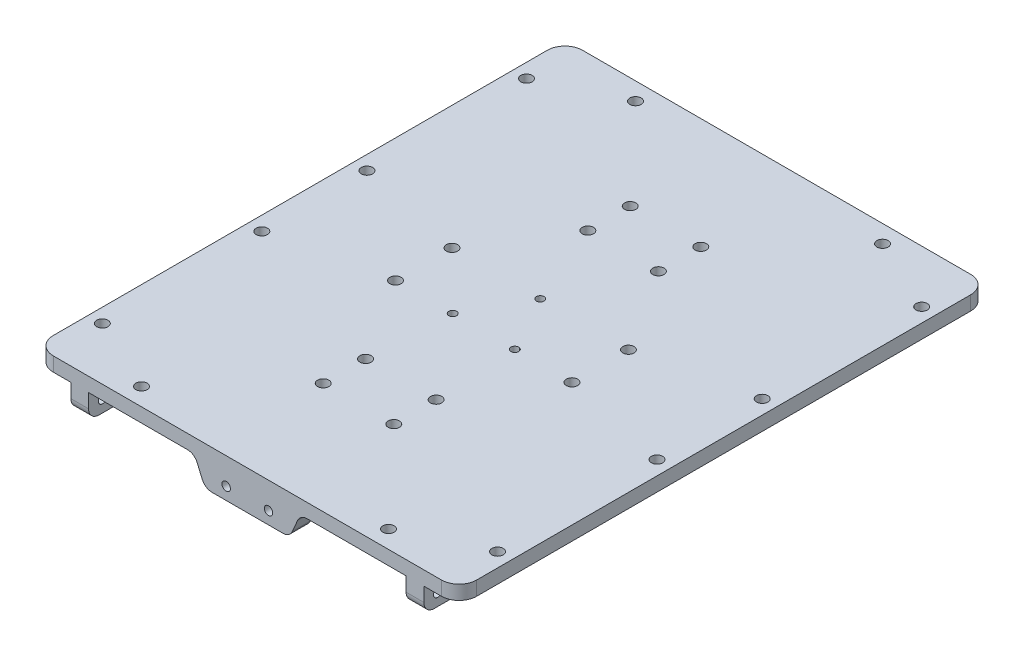
from build123d import *

# Parameters (mm, degrees)
SKETCH_1_W      = 120
SKETCH_1_H      = 150
SKETCH_1_R      = 1.6
SKETCH_1_R_2    = 1.1
EXTRUDE_1_DEPTH = 4
SKETCH_2_R      = 1.25
EXTRUDE_2_DEPTH = 5
SKETCH_3_R      = 1.2
EXTRUDE_3_DEPTH = 5
FILLET_1_R      = 5
FILLET_3_R      = 3


with BuildPart() as part:
    # 草图1 → 凸台-拉伸1 (new body)
    with BuildSketch(Plane(origin=(0, 0, 0), x_dir=(1, 0, 0), z_dir=(0, 1, 0))):
        Rectangle(SKETCH_1_W, SKETCH_1_H)
        with Locations(Location((-56, 60.1, 0), (0, 0, 270))):
            Circle(SKETCH_1_R, mode=Mode.SUBTRACT)
        with Locations(Location((-56, 14.9, 0), (0, 0, 90))):
            Circle(SKETCH_1_R, mode=Mode.SUBTRACT)
        with Locations(Location((-10, 43.5, 0), (0, 0, 270))):
            Circle(SKETCH_1_R, mode=Mode.SUBTRACT)
        with Locations(Location((-10, 31.5, 0), (0, 0, 90))):
            Circle(SKETCH_1_R, mode=Mode.SUBTRACT)
        with Locations(Location((-56, -14.9, 0), (0, 0, 270))):
            Circle(SKETCH_1_R, mode=Mode.SUBTRACT)
        with Locations(Location((-10, -31.5, 0), (0, 0, 270))):
            Circle(SKETCH_1_R, mode=Mode.SUBTRACT)
        with Locations(Location((-10, -43.5, 0), (0, 0, 90))):
            Circle(SKETCH_1_R, mode=Mode.SUBTRACT)
        with Locations(Location((-56, -60.1, 0), (0, 0, 90))):
            Circle(SKETCH_1_R, mode=Mode.SUBTRACT)
        with Locations(Location((56, -60.1, 0), (0, 0, 270))):
            Circle(SKETCH_1_R, mode=Mode.SUBTRACT)
        with Locations(Location((10, -43.5, 0), (0, 0, 270))):
            Circle(SKETCH_1_R, mode=Mode.SUBTRACT)
        with Locations(Location((10, -31.5, 0), (0, 0, 90))):
            Circle(SKETCH_1_R, mode=Mode.SUBTRACT)
        with Locations(Location((56, -14.9, 0), (0, 0, 90))):
            Circle(SKETCH_1_R, mode=Mode.SUBTRACT)
        with Locations(Location((56, 14.9, 0), (0, 0, 270))):
            Circle(SKETCH_1_R, mode=Mode.SUBTRACT)
        with Locations(Location((10, 31.5, 0), (0, 0, 270))):
            Circle(SKETCH_1_R, mode=Mode.SUBTRACT)
        with Locations(Location((10, 43.5, 0), (0, 0, 90))):
            Circle(SKETCH_1_R, mode=Mode.SUBTRACT)
        with Locations(Location((56, 60.1, 0), (0, 0, 90))):
            Circle(SKETCH_1_R, mode=Mode.SUBTRACT)
        with Locations(Location((0, 8, 0), (0, 0, 270))):
            Circle(SKETCH_1_R_2, mode=Mode.SUBTRACT)
        with Locations(Location((8.8, -8, 0), (0, 0, 270))):
            Circle(SKETCH_1_R_2, mode=Mode.SUBTRACT)
        with Locations(Location((-8.8, -8, 0), (0, 0, 270))):
            Circle(SKETCH_1_R_2, mode=Mode.SUBTRACT)
        with Locations(Location((-25, 8, 0), (0, 0, 270))):
            Circle(SKETCH_1_R, mode=Mode.SUBTRACT)
        with Locations(Location((25, 8, 0), (0, 0, 90))):
            Circle(SKETCH_1_R, mode=Mode.SUBTRACT)
        with Locations(Location((25, -8, 0), (0, 0, 270))):
            Circle(SKETCH_1_R, mode=Mode.SUBTRACT)
        with Locations(Location((-25, -8, 0), (0, 0, 90))):
            Circle(SKETCH_1_R, mode=Mode.SUBTRACT)
        with Locations(Location((35, 70, 0), (0, 0, 270))):
            Circle(SKETCH_1_R, mode=Mode.SUBTRACT)
        with Locations(Location((-35, 70, 0), (0, 0, 90))):
            Circle(SKETCH_1_R, mode=Mode.SUBTRACT)
        with Locations(Location((-35, -70, 0), (0, 0, 270))):
            Circle(SKETCH_1_R, mode=Mode.SUBTRACT)
        with Locations(Location((35, -70, 0), (0, 0, 90))):
            Circle(SKETCH_1_R, mode=Mode.SUBTRACT)
    extrude(amount=EXTRUDE_1_DEPTH)

    # 草图2 → 凸台-拉伸2 (add)
    # profile 1 of 3: a face of its own
    with BuildSketch(Plane.ZY.offset(50)):
        Polygon((45, 0), (75, 0), (75, -7), (57.124355653, -7), align=None)
        with Locations((71, -3.5)):
            Circle(SKETCH_2_R, mode=Mode.SUBTRACT)
        with Locations((65, -3.5)):
            Circle(SKETCH_2_R, mode=Mode.SUBTRACT)
        with Locations((59, -3.5)):
            Circle(SKETCH_2_R, mode=Mode.SUBTRACT)
    # profile 2 of 3: a face of its own
    with BuildSketch(Plane.ZY.offset(50)):
        Polygon((-57.124355653, -7), (-75, -7), (-75, 0), (-45, 0), align=None)
        with Locations((-71, -3.5)):
            Circle(SKETCH_2_R, mode=Mode.SUBTRACT)
        with Locations((-65, -3.5)):
            Circle(SKETCH_2_R, mode=Mode.SUBTRACT)
        with Locations((-59, -3.5)):
            Circle(SKETCH_2_R, mode=Mode.SUBTRACT)
    # profile 3 of 3: a face of its own
    with BuildSketch(Plane.ZY.offset(50)):
        Polygon((-25, 0), (25, 0), (17, -7), (-17, -7), align=None)
    extrude_2 = extrude(amount=-EXTRUDE_2_DEPTH)

    # 镜向1: 凸台-拉伸2 across plane
    add(extrude_2.mirror(Plane.ZY))

    # 草图3 → 凸台-拉伸3 (add)
    with BuildSketch(Plane.XY.offset(75)):
        Polygon((-15, 0), (15, 0), (12, -7), (-12, -7), align=None)
        with Locations((6, -3.5)):
            Circle(SKETCH_3_R, mode=Mode.SUBTRACT)
        with Locations(Location((-6, -3.5, 0), (0, 0, 180))):
            Circle(SKETCH_3_R, mode=Mode.SUBTRACT)
    extrude_3 = extrude(amount=-EXTRUDE_3_DEPTH)

    # 镜向2: 凸台-拉伸3 across plane
    add(extrude_3.mirror(Plane.XY))

    # 圆角1
    fillet_1_edges = [part.edges().sort_by_distance(p)[0] for p in [
        (60, 2, 75),
        (-60, 2, 75),
        (-60, 2, -75),
        (60, 2, -75),
    ]]
    fillet(fillet_1_edges, radius=FILLET_1_R)

    # 圆角3
    fillet_3_edges = [part.edges().sort_by_distance(p)[0] for p in [
        (-47.5, 0, 45),
        (-47.5, -7, 57.124355653),
        (-47.5, -7, 75),
        (47.5, -7, 75),
        (47.5, -7, 57.124355653),
        (47.5, 0, 45),
        (47.5, 0, -45),
        (-47.5, 0, -45),
        (47.5, -7, -75),
        (47.5, -7, -57.124355653),
        (-47.5, -7, -57.124355653),
        (-47.5, -7, -75),
        (-47.5, -7, 17),
        (-47.5, 0, 25),
        (-47.5, 0, -25),
        (-47.5, -7, -17),
        (47.5, 0, -25),
        (47.5, -7, -17),
        (47.5, -7, 17),
        (47.5, 0, 25),
        (-12, -7, -72.5),
        (-15, 0, -72.5),
        (12, -7, -72.5),
        (15, 0, -72.5),
        (-12, -7, 72.5),
        (-15, 0, 72.5),
        (12, -7, 72.5),
        (15, 0, 72.5),
    ]]
    fillet(fillet_3_edges, radius=FILLET_3_R)


solid = part.part
